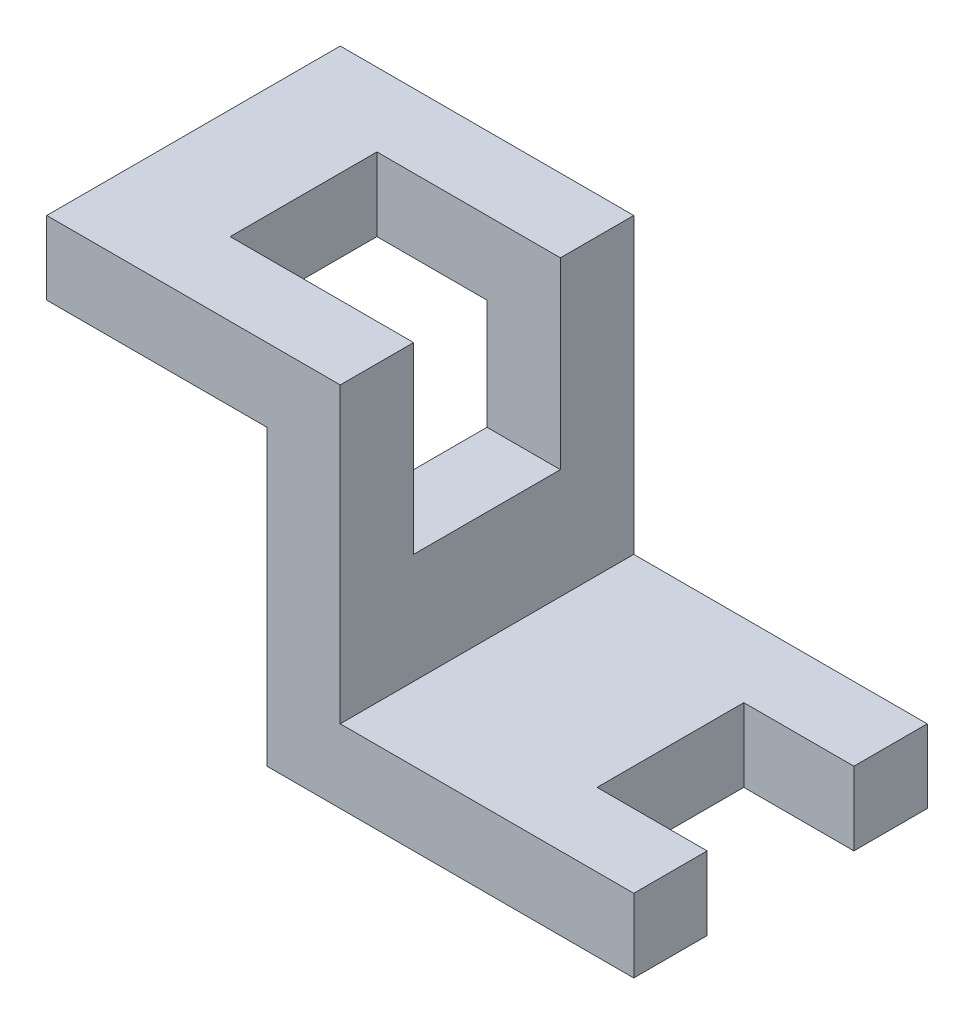
from build123d import *

# Parameters (mm, degrees)
RESSALTO_EXTRUS_O1_DEPTH = 40
ESBO_O2_W                = 20
ESBO_O2_H                = 25
CORTE_EXTRUS_O1_DEPTH    = 25
ESBO_O3_W                = 15
ESBO_O3_H                = 20
CORTE_EXTRUS_O2_DEPTH    = 25


with BuildPart() as part:
    # Esboço1 → Ressalto-extrusão1 (new body)
    with BuildSketch(Plane.XY):
        Polygon((-40, 0), (0, 0), (0, -40), (40, -40), (40, -50), (-10, -50), (-10, -10), (-40, -10), align=None)
    extrude(amount=RESSALTO_EXTRUS_O1_DEPTH)

    # Esboço2 → Corte-extrusão1 (cut)
    with BuildSketch(Plane(origin=(0, 0, 0), x_dir=(0, 0, -1), z_dir=(1, 0, 0))):
        with Locations((-20, -12.5)):
            Rectangle(ESBO_O2_W, ESBO_O2_H)
    extrude(amount=-CORTE_EXTRUS_O1_DEPTH, mode=Mode.SUBTRACT)

    # Esboço3 → Corte-extrusão2 (cut)
    with BuildSketch(Plane(origin=(0, -40, 0), x_dir=(1, 0, 0), z_dir=(0, 1, 0))):
        with Locations((32.5, -20)):
            Rectangle(ESBO_O3_W, ESBO_O3_H)
    extrude(amount=-CORTE_EXTRUS_O2_DEPTH, mode=Mode.SUBTRACT)


solid = part.part
